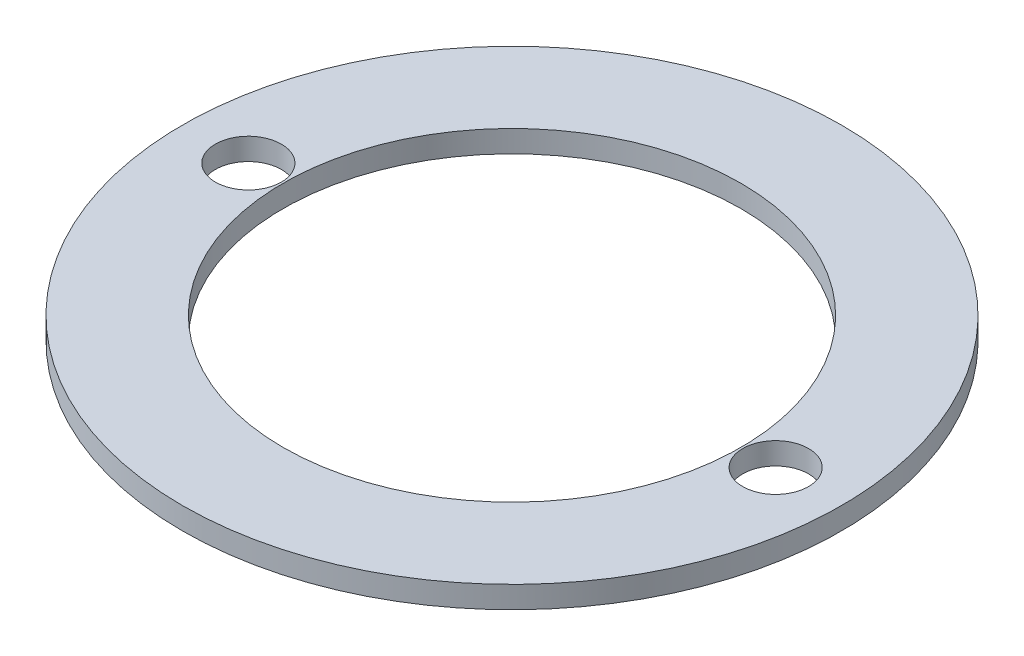
from build123d import *

# Parameters (mm, degrees)
SKETCH1_R           = 22.86
SKETCH1_R_2         = 15.875
SKETCH1_R_3         = 2.286
BOSS_EXTRUDE1_DEPTH = 1.524


with BuildPart() as part:
    # Sketch1 → Boss-Extrude1 (new body)
    with BuildSketch(Plane(origin=(0, 0, 0), x_dir=(1, 0, 0), z_dir=(0, 1, 0))):
        with Locations(Location((0, 0, 0), (0, 0, 90))):
            Circle(SKETCH1_R)
        with Locations(Location((0, 0, 0), (0, 0, 90))):
            Circle(SKETCH1_R_2, mode=Mode.SUBTRACT)
        with Locations(Location((-18.288, 0, 0), (0, 0, 90))):
            Circle(SKETCH1_R_3, mode=Mode.SUBTRACT)
        with Locations(Location((18.288, 0, 0), (0, 0, 90))):
            Circle(SKETCH1_R_3, mode=Mode.SUBTRACT)
    extrude(amount=BOSS_EXTRUDE1_DEPTH)


solid = part.part
